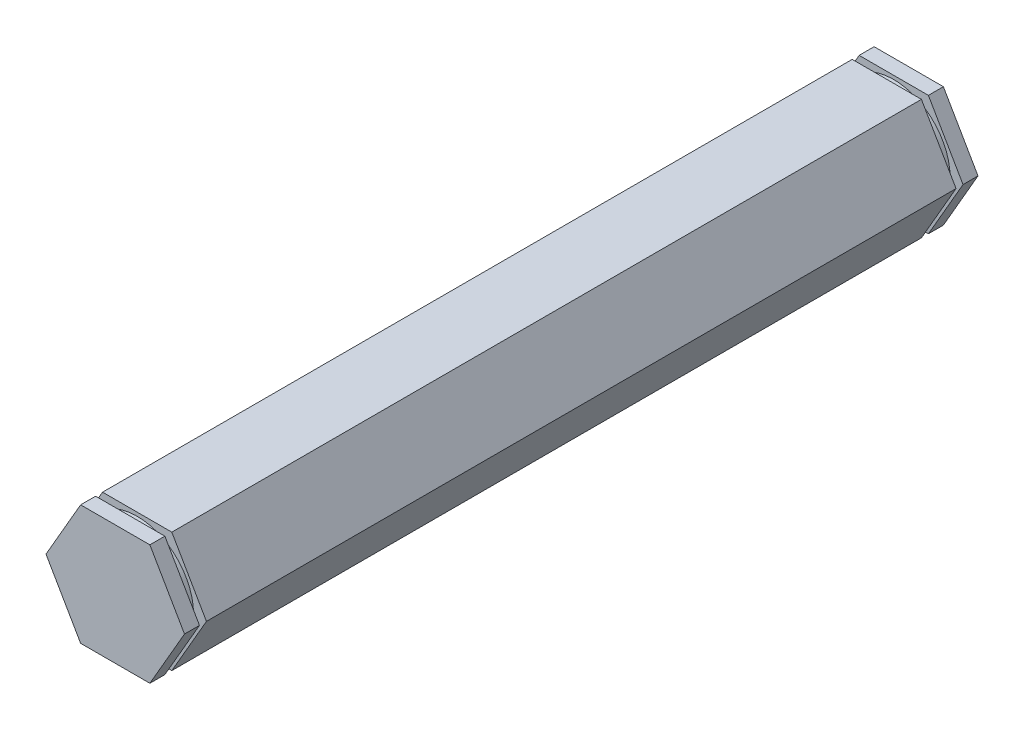
from build123d import *

# Parameters (mm, degrees)
BOSS_EXTRUDE1_DEPTH = 84.0232
SKETCH2_R           = 5.969
CUT_EXTRUDE1_DEPTH  = 0.7366
LPATTERN1_COUNT     = 2
LPATTERN1_PITCH     = 80.1116


with BuildPart() as part:
    # Sketch1 → Boss-Extrude1 (new body)
    with BuildSketch(Plane.XY.offset(31.75)):
        Polygon((7.332348419, 0), (3.666174209, 6.35), (-3.666174209, 6.35), (-7.332348419, 0), (-3.666174209, -6.35), (3.666174209, -6.35), align=None)
    extrude(amount=-BOSS_EXTRUDE1_DEPTH)

    # Sketch2 → Cut-Extrude1 (cut)
    with BuildSketch(Plane.XY.offset(30.1625)):
        Polygon((-3.666174209, -6.35), (3.666174209, -6.35), (7.332348419, 0), (3.666174209, 6.35), (-3.666174209, 6.35), (-7.332348419, 0), align=None)
        Circle(SKETCH2_R, mode=Mode.SUBTRACT)
    cut_extrude1 = extrude(amount=-CUT_EXTRUDE1_DEPTH, mode=Mode.SUBTRACT)

    # LPattern1: Cut-Extrude1 ×2
    with Locations(*[(0, 0, -i * LPATTERN1_PITCH) for i in range(1, LPATTERN1_COUNT)]):
        add(cut_extrude1, mode=Mode.SUBTRACT)


solid = part.part
